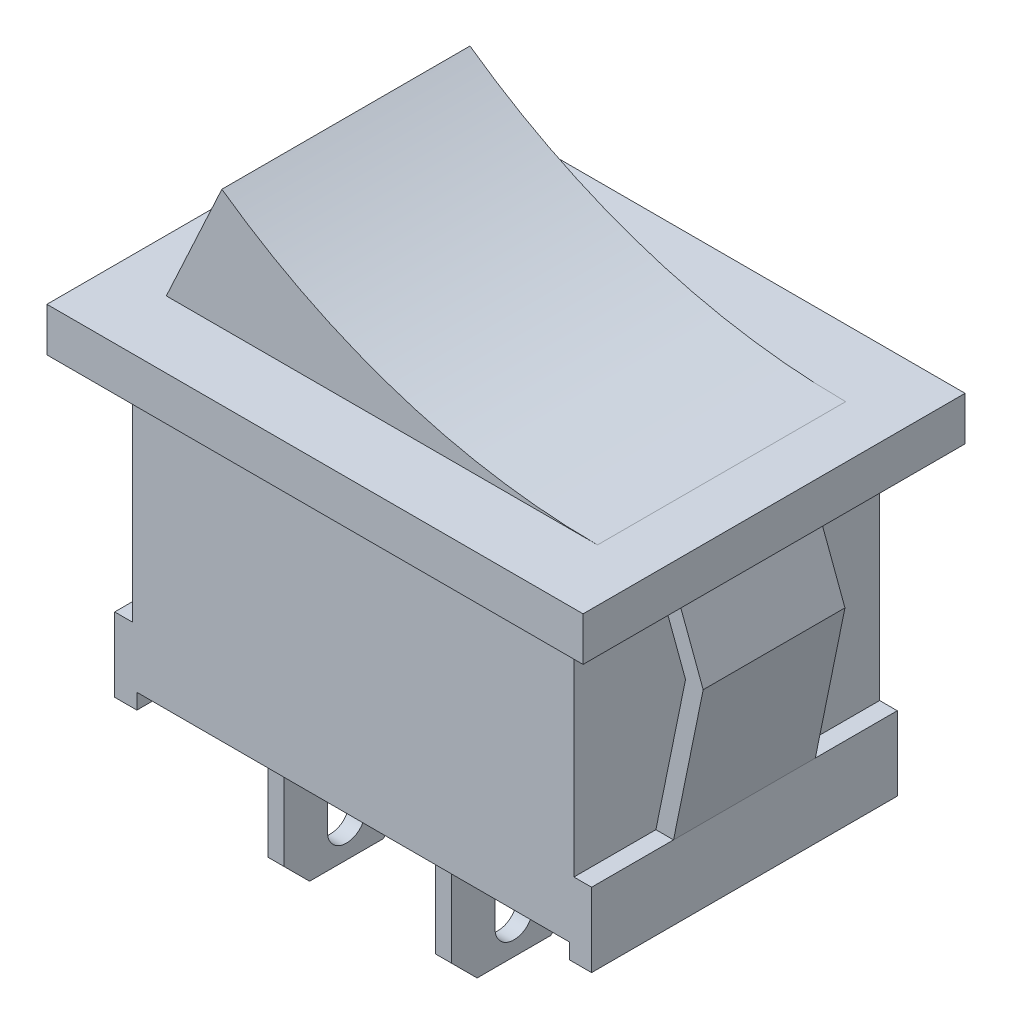
from build123d import *

# Parameters (mm, degrees)
BOSS_EXTRUDE1_DEPTH     = 7.41
CUT_EXTRUDE1_DEPTH      = 15.555353826
CUT_EXTRUDE1_DEPTH_BACK = 15.555353826
SKETCH2_W               = 1.48
SKETCH2_H               = 11.67
BOSS_EXTRUDE2_DEPTH     = 2.75
BOSS_EXTRUDE3_DEPTH     = 4.8125
SKETCH6_R               = 0.820137038
BOSS_EXTRUDE4_DEPTH     = 0.31
LPATTERN1_COUNT         = 2
LPATTERN1_PITCH         = 6.5


with BuildPart() as part:
    # Sketch1 → Boss-Extrude1 (new, symmetric)
    with BuildSketch(Plane.XY):
        Polygon((8.39, -6.985), (9.25, -6.985), (9.25, -4.115), (8.565, -4.115), (8.565, 4.685), (10.4, 4.685), (10.4, 6.385), (-10.4, 6.385), (-10.4, 4.685), (-8.565, 4.685), (-8.565, -4.115), (-9.25, -4.115), (-9.25, -6.985), (-8.39, -6.985), (-8.39, -6.385), (8.39, -6.385), align=None)
    extrude(amount=BOSS_EXTRUDE1_DEPTH, both=True)

    # Sketch2 → Cut-Extrude1 (cut, two sides: drawn at the far end of the back side and taken through both)
    with BuildSketch(Plane(origin=(0, 0, 0), x_dir=(0, 0, -1), z_dir=(1, 0, 0)).offset(-CUT_EXTRUDE1_DEPTH_BACK)):
        with Locations((-6.67, -1.15)):
            Rectangle(SKETCH2_W, SKETCH2_H)
        with Locations((6.67, -1.15)):
            Rectangle(SKETCH2_W, SKETCH2_H)
    extrude(amount=CUT_EXTRUDE1_DEPTH + CUT_EXTRUDE1_DEPTH_BACK, mode=Mode.SUBTRACT)

    # Sketch3 → Boss-Extrude2 (add, symmetric)
    with BuildSketch(Plane.XY):
        Polygon((9.25, -4.115), (10.4, 1.505688207), (9.208432641, 4.685), (8.565, 4.685), (8.565, 4.574090958), (9.715, 1.505688207), (8.565, -4.115), align=None)
        Polygon((-8.565, -4.115), (-9.25, -4.115), (-10.4, 1.505688207), (-9.208432641, 4.685), (-8.565, 4.685), (-8.565, 4.574090958), (-9.715, 1.505688207), align=None)
    extrude(amount=BOSS_EXTRUDE2_DEPTH, both=True)

    # Sketch4 → Boss-Extrude3 (add, symmetric)
    with BuildSketch(Plane.XY):
        with BuildLine():
            Line((-6.210173318, 11.046483266), (-8.365, 6.385))
            Line((-8.365, 6.385), (8.365, 6.385))
            ThreePointArc((8.365, 6.385), (0.713772917, 7.578738259), (-6.210173318, 11.046483266))
        make_face()
    extrude(amount=BOSS_EXTRUDE3_DEPTH, both=True)

    # Sketch6 → Boss-Extrude4 (add, symmetric)
    with BuildSketch(Plane(origin=(0, 0, 0), x_dir=(0, 0, -1), z_dir=(1, 0, 0))):
        Polygon((-2.43, -6.385), (-2.43, -12.885), (-1.43, -13.885), (1.43, -13.885), (2.43, -12.885), (2.43, -6.385), align=None)
        with Locations((0, -8.62789293)):
            Circle(SKETCH6_R, mode=Mode.SUBTRACT)
        with BuildLine():
            Line((0.735277294, -10.583561043), (0.735277294, -12.583561043))
            ThreePointArc((0.735277294, -12.583561043), (0, -13.318838337), (-0.735277294, -12.583561043))
            Line((-0.735277294, -12.583561043), (-0.735277294, -10.583561043))
            ThreePointArc((-0.735277294, -10.583561043), (0, -9.848283749), (0.735277294, -10.583561043))
        make_face(mode=Mode.SUBTRACT)
    boss_extrude4 = extrude(amount=BOSS_EXTRUDE4_DEPTH, both=True)

    # LPattern1: Boss-Extrude4 ×2
    with Locations(*[(-i * LPATTERN1_PITCH, 0, 0) for i in range(1, LPATTERN1_COUNT)]):
        add(boss_extrude4)


solid = part.part
